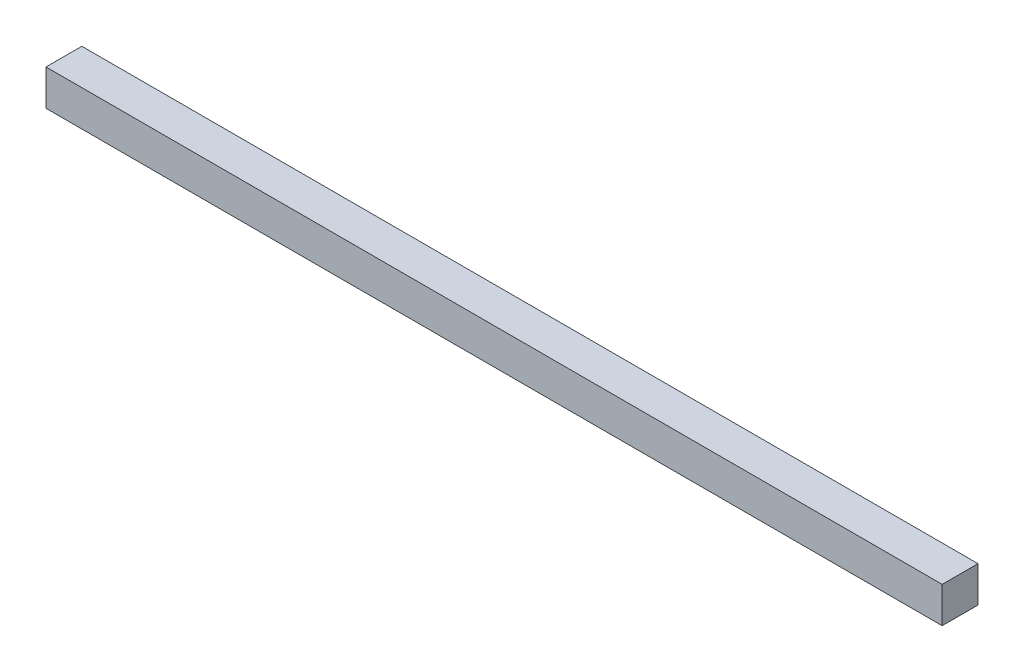
from build123d import *

# Parameters (mm, degrees)
SKETCH1_W           = 100
SKETCH1_H           = 100
BOSS_EXTRUDE1_DEPTH = 1250


with BuildPart() as part:
    # Sketch1 → Boss-Extrude1 (new, symmetric)
    with BuildSketch(Plane(origin=(0, 0, 0), x_dir=(0, 0, -1), z_dir=(1, 0, 0))):
        Rectangle(SKETCH1_W, SKETCH1_H)
    extrude(amount=BOSS_EXTRUDE1_DEPTH, both=True)


solid = part.part
